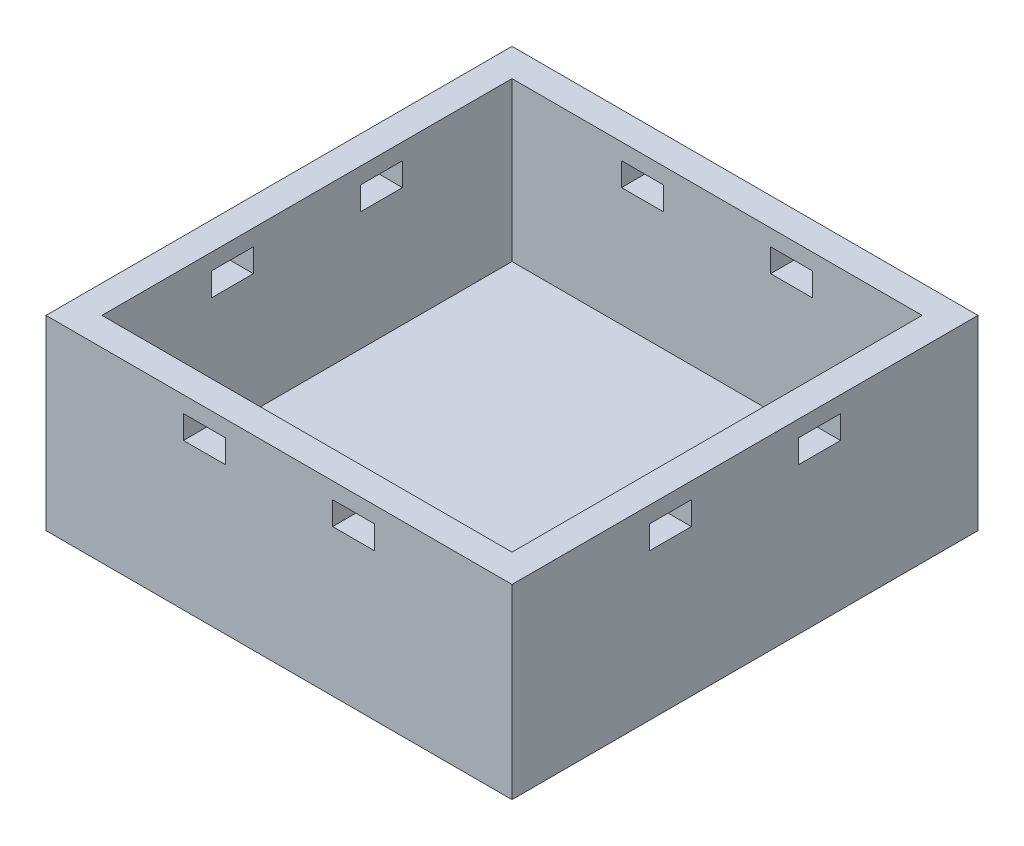
from build123d import *

# Parameters (mm, degrees)
SKETCH_1_W          = 50
SKETCH_1_H          = 50
EXTRUDE_1_DEPTH     = 3
SKETCH_2_W          = 50
SKETCH_2_H          = 50
SKETCH_2_W_2        = 44
SKETCH_2_H_2        = 44
EXTRUDE_2_DEPTH     = 17
SKETCH_3_W          = 4.5
SKETCH_3_H          = 2.5
CUT_EXTRUDE_1_DEPTH = 60.371710435
SKETCH_4_W          = 4.5
SKETCH_4_H          = 2.5
CUT_EXTRUDE_2_DEPTH = 60.371710435


with BuildPart() as part:
    # 草图1 → 凸台-拉伸1 (new body)
    with BuildSketch(Plane(origin=(0, 0, 0), x_dir=(1, 0, 0), z_dir=(0, 1, 0))):
        Rectangle(SKETCH_1_W, SKETCH_1_H)
    extrude(amount=EXTRUDE_1_DEPTH)

    # 草图2 → 凸台-拉伸2 (add)
    with BuildSketch(Plane(origin=(0, 3, 0), x_dir=(1, 0, 0), z_dir=(0, 1, 0))):
        Rectangle(SKETCH_2_W, SKETCH_2_H)
        Rectangle(SKETCH_2_W_2, SKETCH_2_H_2, mode=Mode.SUBTRACT)
    extrude(amount=EXTRUDE_2_DEPTH)

    # 草图3 → 切除-拉伸1 (cut, through all)
    with BuildSketch(Plane.XY.offset(25)):
        with Locations((-8, 17)):
            Rectangle(SKETCH_3_W, SKETCH_3_H)
        with Locations((8, 17)):
            Rectangle(SKETCH_3_W, SKETCH_3_H)
    extrude(amount=-CUT_EXTRUDE_1_DEPTH, mode=Mode.SUBTRACT)

    # 草图4 → 切除-拉伸2 (cut, through all)
    with BuildSketch(Plane(origin=(25, 0, 0), x_dir=(0, 0, -1), z_dir=(1, 0, 0))):
        with Locations((-8, 17)):
            Rectangle(SKETCH_4_W, SKETCH_4_H)
        with Locations((8, 17)):
            Rectangle(SKETCH_4_W, SKETCH_4_H)
    extrude(amount=-CUT_EXTRUDE_2_DEPTH, mode=Mode.SUBTRACT)


solid = part.part
